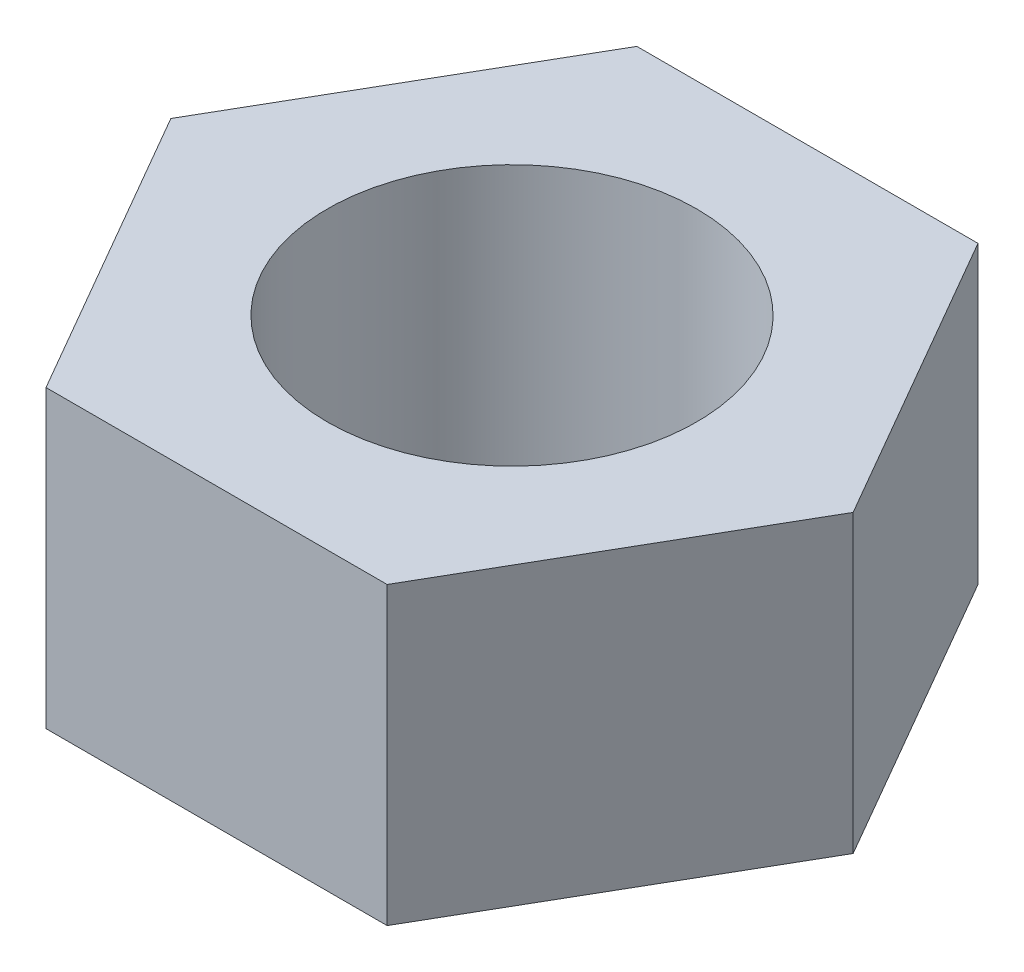
from build123d import *

# Parameters (mm, degrees)
SKETCH_1_R      = 2.5
EXTRUDE_1_DEPTH = 4


with BuildPart() as part:
    # 草图1 → 凸台-拉伸1 (new body)
    with BuildSketch(Plane(origin=(0, 0, 0), x_dir=(1, 0, 0), z_dir=(0, 1, 0))):
        Polygon((4.618802154, 0), (2.309401077, 4), (-2.309401077, 4), (-4.618802154, 0), (-2.309401077, -4), (2.309401077, -4), align=None)
        with Locations(Location((0, 0, 0), (0, 0, 270))):
            Circle(SKETCH_1_R, mode=Mode.SUBTRACT)
    extrude(amount=EXTRUDE_1_DEPTH)


solid = part.part
